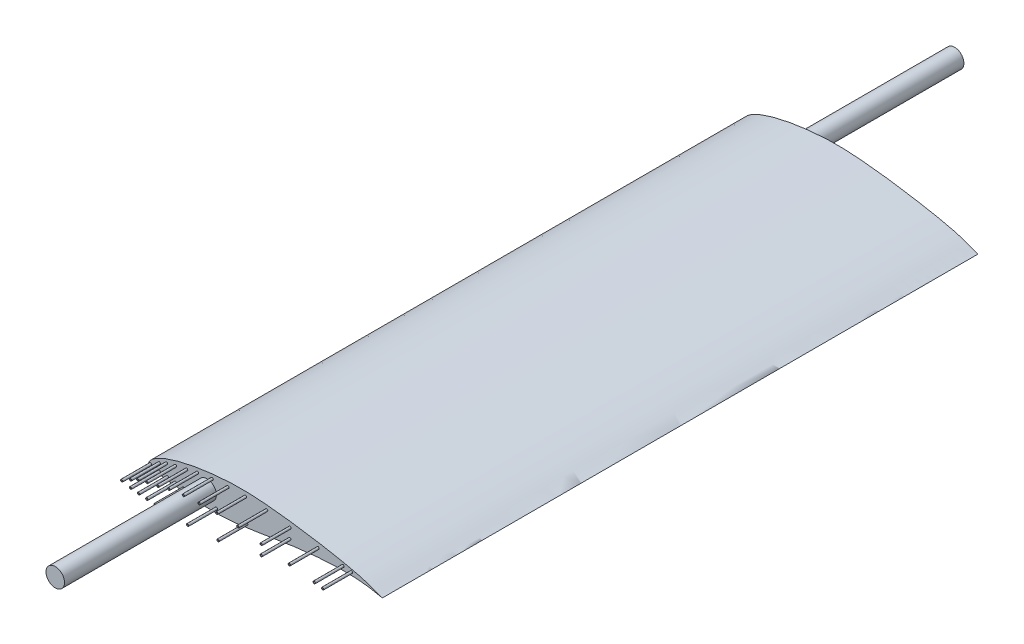
from build123d import *

# Parameters (mm, degrees)
BOSS_EXTRUDE12_DEPTH = 127.5
SKETCH5_R            = 3.96875
BOSS_EXTRUDE13_DEPTH = 65
SKETCH6_R            = 0.495
SKETCH6_R_2          = 0.325
BOSS_EXTRUDE14_DEPTH = 12.3


with BuildPart() as part:
    # Sketch4 → Boss-Extrude12 (new, symmetric)
    with BuildSketch(Plane.XY):
        with BuildLine():
            add(Edge.make_bspline(
                [(100, 0), (99.999815651, 0.00219446), (99.296084263, 0.199325454), (98.61912609, 0.462023876), (97.051903925, 1.047271604), (95.230890561, 1.754893562), (92.9377884, 2.556822624), (90.25359521, 3.333646696), (87.14769009, 4.081591717), (83.653453523, 4.844892949), (79.805092278, 5.612624789), (75.655096387, 6.378178082), (71.256775037, 7.128421187), (66.666591084, 7.848408623), (61.942283988, 8.521247582), (57.141991664, 9.126935326), (52.323298642, 9.644744891), (47.542171635, 10.046664095), (42.847412803, 10.315684788), (38.250859013, 10.364237329), (33.766527631, 10.18589116), (29.404540771, 9.859979537), (25.205664918, 9.396335122), (21.214632991, 8.814476405), (17.473244617, 8.129616096), (14.021102758, 7.355738731), (10.893158298, 6.510046925), (8.121057405, 5.603939), (5.729621281, 4.65858742), (3.739238835, 3.686482523), (2.162902466, 2.71622035), (1.005702209, 1.767062286), (0.309881961, 0.924053983), (0.033562392, 0.326864353), (0.000585058, 0.059003832), (-0.000483325, -0.044055324), (0.008656559, -0.147243843), (0.097628215, -0.280738124), (0.217608326, -0.405627954), (0.606875055, -0.718520627), (1.515593418, -1.12387328), (3.070469813, -1.582990093), (5.152338499, -2.007169493), (7.727947017, -2.391694307), (10.775863297, -2.749884099), (14.2510745, -3.07721248), (18.040671125, -3.477315031), (22.041442034, -3.906718484), (26.216607049, -4.117145276), (30.556543108, -4.098285525), (35.101357612, -3.847566364), (39.855502399, -3.292896418), (44.853099151, -2.569694917), (50.077701264, -1.697246438), (55.496912305, -0.808938969), (61.034492206, 0.024429539), (66.590101657, 0.742311194), (72.054909857, 1.301282359), (77.316713376, 1.672844408), (82.260760219, 1.841731341), (86.778399144, 1.811995519), (90.728856588, 1.57974732), (94.04764875, 1.181997505), (96.524332979, 0.771531232), (98.476024493, 0.356901303), (99.25725067, 0.188333084), (100.000186154, -0.002215951), (100, 0)],
                knots=[0, 0, 0, 0, 0.001709346, 0.006654569, 0.014347849, 0.024259402, 0.036041711, 0.049641116, 0.065254712, 0.082792535, 0.102030591, 0.122721356, 0.144596581, 0.167375109, 0.190767639, 0.214482745, 0.238232803, 0.261741379, 0.284746803, 0.307088371, 0.329034071, 0.350454748, 0.371139118, 0.390890019, 0.409511982, 0.426831344, 0.442689348, 0.456949713, 0.469522756, 0.480321822, 0.489349767, 0.496580446, 0.502134718, 0.505253957, 0.506016052, 0.506062921, 0.506764306, 0.507485535, 0.508355904, 0.509303967, 0.514776148, 0.522722026, 0.533080486, 0.545839741, 0.560863123, 0.578017517, 0.59696103, 0.61667464, 0.636937396, 0.658148346, 0.680211445, 0.703561467, 0.728221439, 0.754163514, 0.781135914, 0.808648743, 0.836174178, 0.863169877, 0.889092097, 0.913409262, 0.93561843, 0.955186622, 0.971480112, 0.984125393, 0.993028694, 0.998273914, 1, 1, 1, 1], degree=3))
        make_face()
    extrude(amount=BOSS_EXTRUDE12_DEPTH, both=True)

    # Sketch5 → Boss-Extrude13 (add)
    with BuildSketch(Plane.XY.offset(127.5)):
        with Locations(Location((25, 2.7, 0), (0, 0, 180))):
            Circle(SKETCH5_R)
    boss_extrude13 = extrude(amount=BOSS_EXTRUDE13_DEPTH)

    # Mirror1: Boss-Extrude13 across plane
    add(boss_extrude13.mirror(Plane.XY))

    # Sketch6 → Boss-Extrude14 (add)
    # profile 1 of 21: a face of its own
    with BuildSketch(Plane.XY.offset(127.5)):
        with Locations(Location((0.75, 0, 0), (0, 0, 180))):
            Circle(SKETCH6_R)
        with Locations((0.75, 0)):
            Circle(SKETCH6_R_2, mode=Mode.SUBTRACT)
    # profile 2 of 21: a face of its own
    with BuildSketch(Plane.XY.offset(127.5)):
        with Locations(Location((86.76, 3, 0), (0, 0, 180))):
            Circle(SKETCH6_R)
        with Locations((86.76, 3)):
            Circle(SKETCH6_R_2, mode=Mode.SUBTRACT)
    # profile 3 of 21: a face of its own
    with BuildSketch(Plane.XY.offset(127.5)):
        with Locations(Location((83.16, 3.5, 0), (0, 0, 180))):
            Circle(SKETCH6_R)
        with Locations((83.16, 3.5)):
            Circle(SKETCH6_R_2, mode=Mode.SUBTRACT)
    # profile 4 of 21: a face of its own
    with BuildSketch(Plane.XY.offset(127.5)):
        with Locations(Location((72.5, 4.8, 0), (0, 0, 180))):
            Circle(SKETCH6_R)
        with Locations((72.5, 4.8)):
            Circle(SKETCH6_R_2, mode=Mode.SUBTRACT)
    # profile 5 of 21: a face of its own
    with BuildSketch(Plane.XY.offset(127.5)):
        with Locations(Location((60.442948122, 6.3, 0), (0, 0, 180))):
            Circle(SKETCH6_R)
        with Locations((60.442948122, 6.3)):
            Circle(SKETCH6_R_2, mode=Mode.SUBTRACT)
    # profile 6 of 21: a face of its own
    with BuildSketch(Plane.XY.offset(127.5)):
        with Locations(Location((60.442948122, 2.15, 0), (0, 0, 180))):
            Circle(SKETCH6_R)
        with Locations((60.442948122, 2.15)):
            Circle(SKETCH6_R_2, mode=Mode.SUBTRACT)
    # profile 7 of 21: a face of its own
    with BuildSketch(Plane.XY.offset(127.5)):
        with Locations(Location((50.465206467, 7.80092354, 0), (0, 0, 180))):
            Circle(SKETCH6_R)
        with Locations((50.465206467, 7.80092354)):
            Circle(SKETCH6_R_2, mode=Mode.SUBTRACT)
    # profile 8 of 21: a face of its own
    with BuildSketch(Plane.XY.offset(127.5)):
        with Locations(Location((41.41991965, 8.317049878, 0), (0, 0, 180))):
            Circle(SKETCH6_R)
        with Locations((41.41991965, 8.317049878)):
            Circle(SKETCH6_R_2, mode=Mode.SUBTRACT)
    # profile 9 of 21: a face of its own
    with BuildSketch(Plane.XY.offset(127.5)):
        with Locations(Location((33.87991965, 8.117049878, 0), (0, 0, 180))):
            Circle(SKETCH6_R)
        with Locations((33.87991965, 8.117049878)):
            Circle(SKETCH6_R_2, mode=Mode.SUBTRACT)
    # profile 10 of 21: a face of its own
    with BuildSketch(Plane.XY.offset(127.5)):
        with Locations(Location((27.13991965, 7.767049878, 0), (0, 0, 180))):
            Circle(SKETCH6_R)
        with Locations((27.13991965, 7.767049878)):
            Circle(SKETCH6_R_2, mode=Mode.SUBTRACT)
    # profile 11 of 21: a face of its own
    with BuildSketch(Plane.XY.offset(127.5)):
        with Locations(Location((20.90991965, 6.967049878, 0), (0, 0, 180))):
            Circle(SKETCH6_R)
        with Locations((20.90991965, 6.967049878)):
            Circle(SKETCH6_R_2, mode=Mode.SUBTRACT)
    # profile 12 of 21: a face of its own
    with BuildSketch(Plane.XY.offset(127.5)):
        with Locations(Location((16.221039186, 5.767049878, 0), (0, 0, 180))):
            Circle(SKETCH6_R)
        with Locations((16.221039186, 5.767049878)):
            Circle(SKETCH6_R_2, mode=Mode.SUBTRACT)
    # profile 13 of 21: a face of its own
    with BuildSketch(Plane.XY.offset(127.5)):
        with Locations(Location((11.485471639, 4.767049878, 0), (0, 0, 180))):
            Circle(SKETCH6_R)
        with Locations((11.485471639, 4.767049878)):
            Circle(SKETCH6_R_2, mode=Mode.SUBTRACT)
    # profile 14 of 21: a face of its own
    with BuildSketch(Plane.XY.offset(127.5)):
        with Locations(Location((7.612488292, 3.767049878, 0), (0, 0, 180))):
            Circle(SKETCH6_R)
        with Locations((7.612488292, 3.767049878)):
            Circle(SKETCH6_R_2, mode=Mode.SUBTRACT)
    # profile 15 of 21: a face of its own
    with BuildSketch(Plane.XY.offset(127.5)):
        with Locations(Location((4.505641016, 2.267049878, 0), (0, 0, 180))):
            Circle(SKETCH6_R)
        with Locations((4.505641016, 2.267049878)):
            Circle(SKETCH6_R_2, mode=Mode.SUBTRACT)
    # profile 16 of 21: a face of its own
    with BuildSketch(Plane.XY.offset(127.5)):
        with Locations(Location((4.505641016, -0.85, 0), (0, 0, 180))):
            Circle(SKETCH6_R)
        with Locations((4.505641016, -0.85)):
            Circle(SKETCH6_R_2, mode=Mode.SUBTRACT)
    # profile 17 of 21: a face of its own
    with BuildSketch(Plane.XY.offset(127.5)):
        with Locations(Location((7.992760171, -1.15, 0), (0, 0, 180))):
            Circle(SKETCH6_R)
        with Locations((7.992760171, -1.15)):
            Circle(SKETCH6_R_2, mode=Mode.SUBTRACT)
    # profile 18 of 21: a face of its own
    with BuildSketch(Plane.XY.offset(127.5)):
        with Locations(Location((11.479879325, -1.45, 0), (0, 0, 180))):
            Circle(SKETCH6_R)
        with Locations((11.479879325, -1.45)):
            Circle(SKETCH6_R_2, mode=Mode.SUBTRACT)
    # profile 19 of 21: a face of its own
    with BuildSketch(Plane.XY.offset(127.5)):
        with Locations(Location((14.956947056, -1.85, 0), (0, 0, 180))):
            Circle(SKETCH6_R)
        with Locations((14.956947056, -1.85)):
            Circle(SKETCH6_R_2, mode=Mode.SUBTRACT)
    # profile 20 of 21: a face of its own
    with BuildSketch(Plane.XY.offset(127.5)):
        with Locations(Location((28.948015635, -2.35, 0), (0, 0, 180))):
            Circle(SKETCH6_R)
        with Locations((28.948015635, -2.35)):
            Circle(SKETCH6_R_2, mode=Mode.SUBTRACT)
    # profile 21 of 21: a face of its own
    with BuildSketch(Plane.XY.offset(127.5)):
        with Locations(Location((41.923376902, -1.55, 0), (0, 0, 180))):
            Circle(SKETCH6_R)
        with Locations((41.923376902, -1.55)):
            Circle(SKETCH6_R_2, mode=Mode.SUBTRACT)
    extrude(amount=BOSS_EXTRUDE14_DEPTH)


solid = part.part
